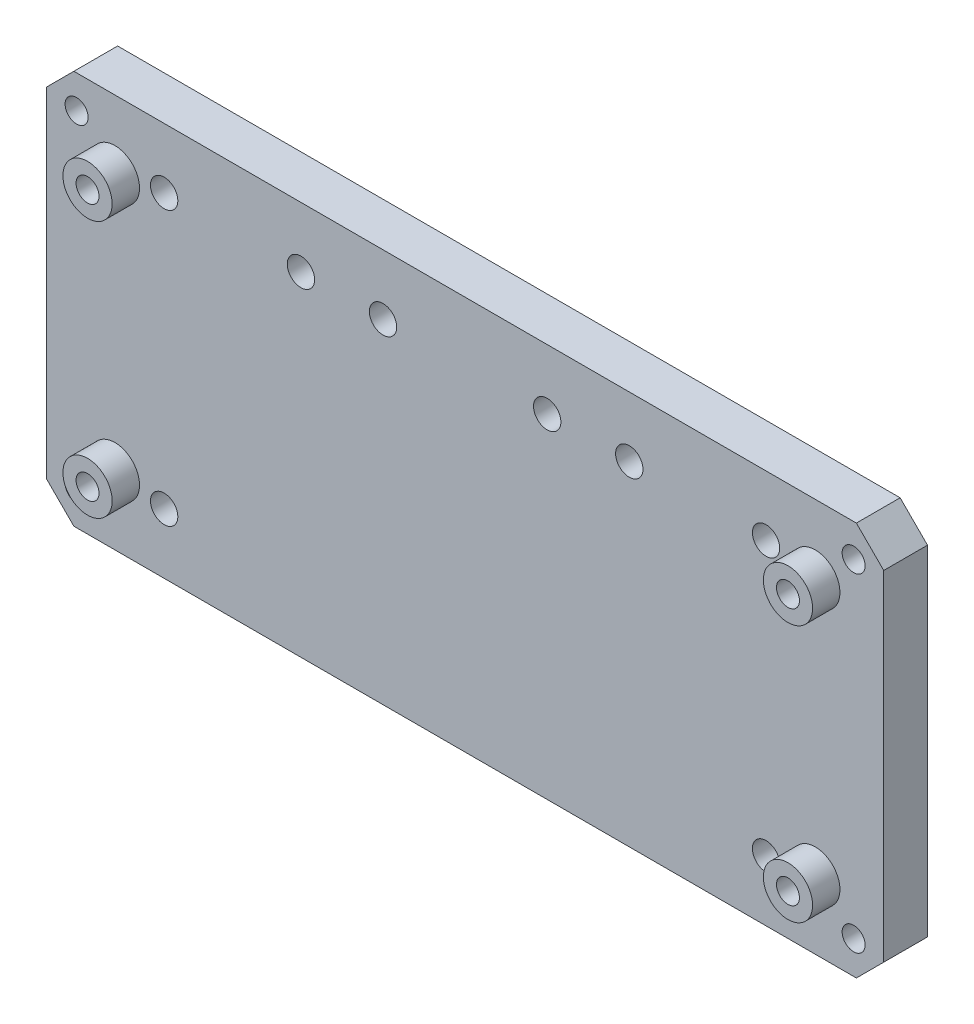
from build123d import *

# Parameters (mm, degrees)
SKETCH1_W           = 153
SKETCH1_H           = 72
SKETCH1_R           = 2.5
BOSS_EXTRUDE1_DEPTH = 8
SKETCH2_R           = 4.5
SKETCH2_R_2         = 2.1
BOSS_EXTRUDE2_DEPTH = 5
CHAMFER1_SIZE       = 5
SKETCH3_R           = 2.1
CUT_EXTRUDE1_DEPTH  = 5


with BuildPart() as part:
    # Sketch1 → Boss-Extrude1 (new body)
    with BuildSketch(Plane.XY):
        with Locations((76.5, 36)):
            Rectangle(SKETCH1_W, SKETCH1_H)
        with Locations((21.5, 61)):
            Circle(SKETCH1_R, mode=Mode.SUBTRACT)
        with Locations(Location((21.5, 11, 0), (0, 0, 180))):
            Circle(SKETCH1_R, mode=Mode.SUBTRACT)
        with Locations(Location((131.5, 61, 0), (0, 0, 180))):
            Circle(SKETCH1_R, mode=Mode.SUBTRACT)
        with Locations((131.5, 11)):
            Circle(SKETCH1_R, mode=Mode.SUBTRACT)
        with Locations((61.5, 61)):
            Circle(SKETCH1_R, mode=Mode.SUBTRACT)
        with Locations((46.5, 61)):
            Circle(SKETCH1_R, mode=Mode.SUBTRACT)
        with Locations(Location((106.5, 61, 0), (0, 0, 180))):
            Circle(SKETCH1_R, mode=Mode.SUBTRACT)
        with Locations(Location((91.5, 61, 0), (0, 0, 180))):
            Circle(SKETCH1_R, mode=Mode.SUBTRACT)
    extrude(amount=BOSS_EXTRUDE1_DEPTH)

    # Sketch2 → Boss-Extrude2 (add)
    # profile 1 of 4: a face of its own
    with BuildSketch(Plane.XY.offset(8)):
        with Locations(Location((12.5, 59.5, 0), (0, 0, 180))):
            Circle(SKETCH2_R)
        with Locations((12.5, 59.5)):
            Circle(SKETCH2_R_2, mode=Mode.SUBTRACT)
    # profile 2 of 4: a face of its own
    with BuildSketch(Plane.XY.offset(8)):
        with Locations(Location((12.5, 12.5, 0), (0, 0, 180))):
            Circle(SKETCH2_R)
        with Locations(Location((12.5, 12.5, 0), (0, 0, 180))):
            Circle(SKETCH2_R_2, mode=Mode.SUBTRACT)
    # profile 3 of 4: a face of its own
    with BuildSketch(Plane.XY.offset(8)):
        with Locations(Location((140.5, 59.5, 0), (0, 0, 180))):
            Circle(SKETCH2_R)
        with Locations(Location((140.5, 59.5, 0), (0, 0, 180))):
            Circle(SKETCH2_R_2, mode=Mode.SUBTRACT)
    # profile 4 of 4: a face of its own
    with BuildSketch(Plane.XY.offset(8)):
        with Locations(Location((140.5, 12.5, 0), (0, 0, 180))):
            Circle(SKETCH2_R)
        with Locations((140.5, 12.5)):
            Circle(SKETCH2_R_2, mode=Mode.SUBTRACT)
    extrude(amount=BOSS_EXTRUDE2_DEPTH)

    # Chamfer1
    chamfer1_edges = [part.edges().sort_by_distance(p)[0] for p in [
        (0, 72, 4),
        (153, 72, 4),
        (153, 0, 4),
        (0, 0, 4),
    ]]
    chamfer(chamfer1_edges, length=CHAMFER1_SIZE)

    # Sketch3 → Cut-Extrude1 (cut)
    with BuildSketch(Plane.XY.offset(8)):
        with Locations((5.5, 6)):
            Circle(SKETCH3_R)
        with Locations(Location((5.5, 66, 0), (0, 0, 180))):
            Circle(SKETCH3_R)
        with Locations(Location((147.5, 6, 0), (0, 0, 180))):
            Circle(SKETCH3_R)
        with Locations((147.5, 66)):
            Circle(SKETCH3_R)
    extrude(amount=-CUT_EXTRUDE1_DEPTH, mode=Mode.SUBTRACT)


solid = part.part
